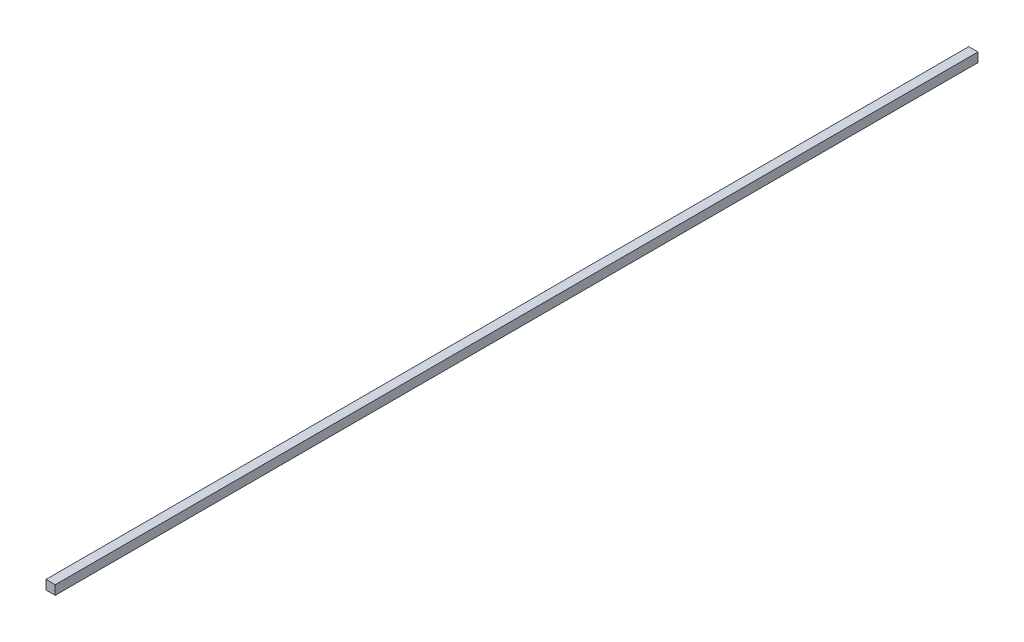
from build123d import *

# Parameters (mm, degrees)
SKETCH1_W           = 20
SKETCH1_H           = 20
BOSS_EXTRUDE1_DEPTH = 2000


with BuildPart() as part:
    # Sketch1 → Boss-Extrude1 (new body)
    with BuildSketch(Plane.XY):
        Rectangle(SKETCH1_W, SKETCH1_H)
    extrude(amount=BOSS_EXTRUDE1_DEPTH)


solid = part.part
